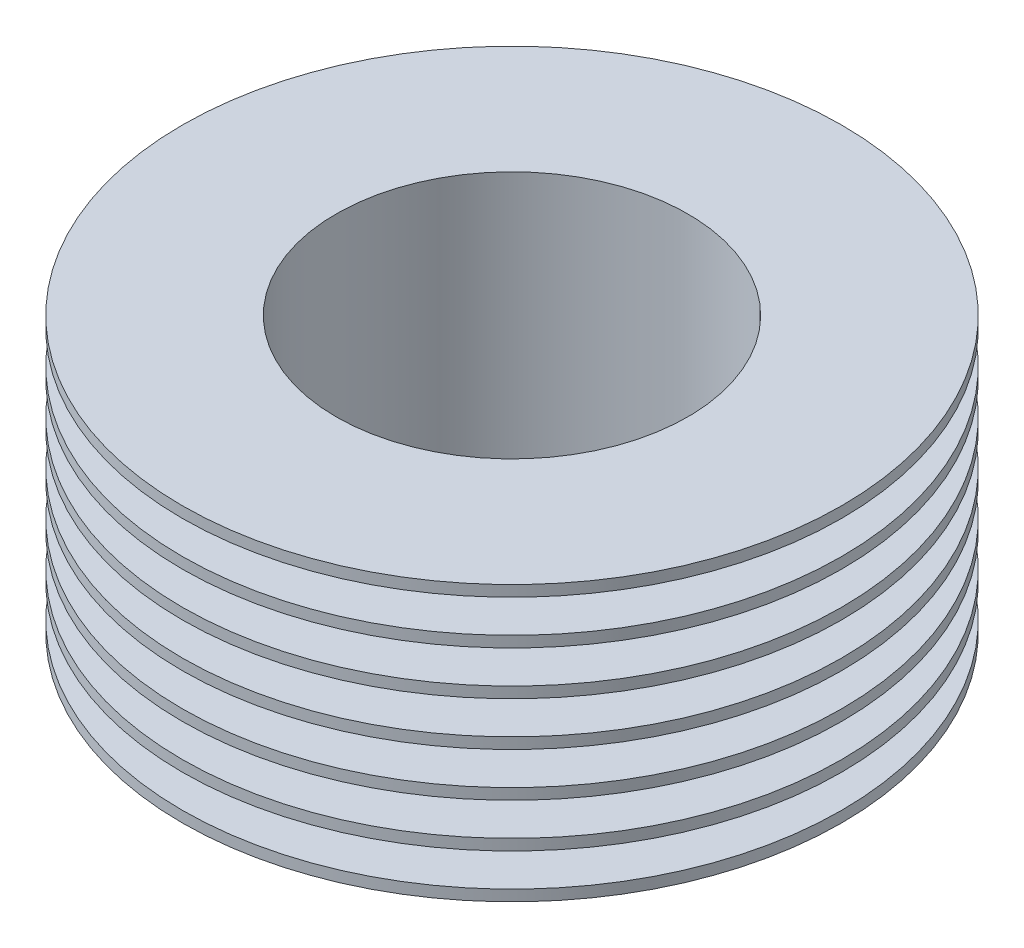
from build123d import *

# Parameters (mm, degrees)
LPATTERN1_COUNT    = 7
LPATTERN1_PITCH    = 4
SKETCH3_R          = 19.047367533
CUT_EXTRUDE3_DEPTH = 4


with BuildPart() as part:
    # Sketch1 → Revolve1 (revolve)
    with BuildSketch(Plane(origin=(0, 0, 0), x_dir=(0, 0, -1), z_dir=(1, 0, 0))):
        Polygon((-18, 13.838658872), (-18, 9.838658872), (-30, 9.838658872), (-30, 8.838658872), (-16, 8.838658872), (-16, 13.838658872), align=None)
    revolve1 = revolve(axis=Axis((0, 28.058626224, 0), (0, -1, 0)))

    # LPattern1: Revolve1 ×7
    with Locations(*[(0, i * LPATTERN1_PITCH, 0) for i in range(1, LPATTERN1_COUNT)]):
        add(revolve1)

    # Sketch3 → Cut-Extrude3 (cut)
    with BuildSketch(Plane(origin=(0, 37.838658872, 0), x_dir=(1, 0, 0), z_dir=(0, 1, 0))):
        Circle(SKETCH3_R)
    extrude(amount=-CUT_EXTRUDE3_DEPTH, mode=Mode.SUBTRACT)


solid = part.part
